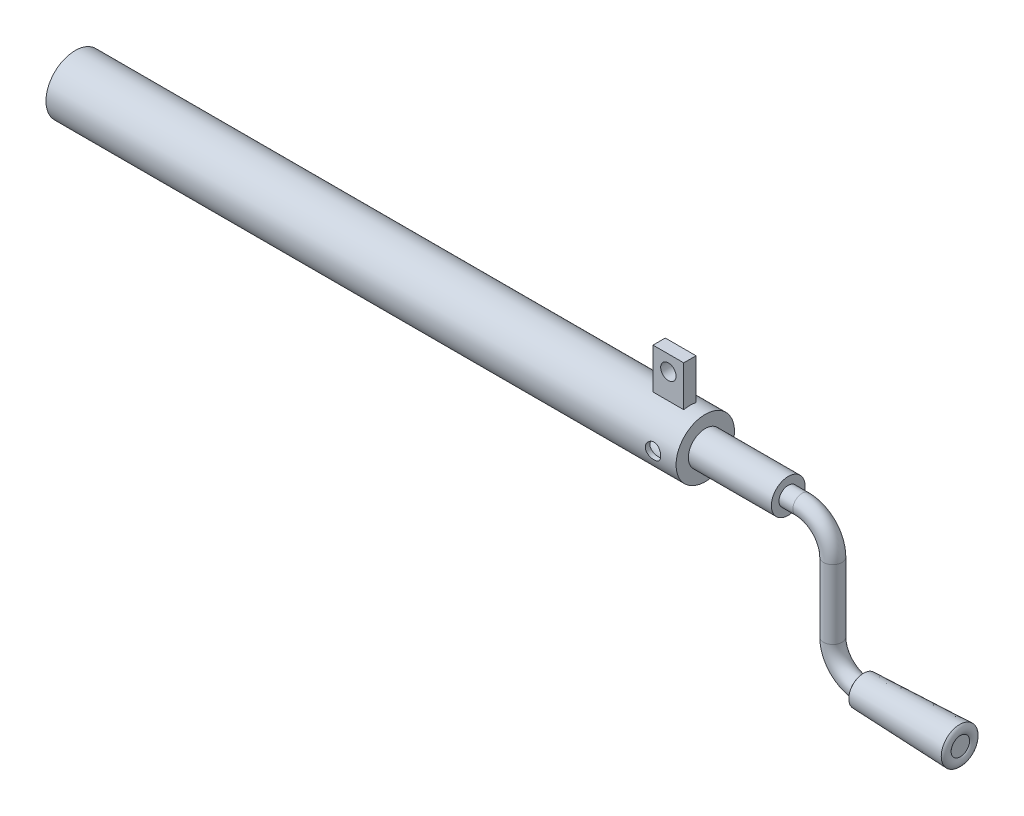
from build123d import *

# Parameters (mm, degrees)
SKETCH1_R                = 19
SKETCH1_R_2              = 16
BOSS_EXTRUDE1_DEPTH      = 410
SKETCH2_R                = 5
CUT_EXTRUDE1_DEPTH       = 30
BOSS_EXTRUDE2_REACH      = 417.4
BOSS_EXTRUDE2_END_RADIUS = 19
SKETCH3_W                = 20
SKETCH3_H                = 8
SKETCH4_R                = 5
CUT_EXTRUDE2_DEPTH       = 10
SWEEP1_PROFILE_R         = 6
BOSS_EXTRUDE3_START      = -10
SKETCH18_R               = 16
BOSS_EXTRUDE3_DEPTH      = 10
SKETCH19_R               = 11
SKETCH19_R_2             = 6
EXTRUDE_THIN1_DEPTH      = 54


with BuildPart() as part:
    # Sketch1 → Boss-Extrude1 (new body)
    with BuildSketch(Plane(origin=(0, 0, 0), x_dir=(0, 0, -1), z_dir=(1, 0, 0))):
        with Locations(Location((0, 0, 0), (0, 0, 180))):
            Circle(SKETCH1_R)
        with Locations(Location((0, 0, 0), (0, 0, 180))):
            Circle(SKETCH1_R_2, mode=Mode.SUBTRACT)
    extrude(amount=BOSS_EXTRUDE1_DEPTH)

    # Sketch2 → Cut-Extrude1 (cut, symmetric)
    with BuildSketch(Plane.XY):
        with Locations((395, 0)):
            Circle(SKETCH2_R)
    extrude(amount=CUT_EXTRUDE1_DEPTH, both=True, mode=Mode.SUBTRACT)

    # Boss-Extrude2: up to this cylinder (the profile starts outside it)
    boss_extrude2_end = Plane(origin=(390, 0, 0), z_dir=(-1, 0, 0)) * Cylinder(BOSS_EXTRUDE2_END_RADIUS, 873.8, mode=Mode.PRIVATE)
    # Sketch3 → Boss-Extrude2 (add, up to the surface)
    with BuildSketch(Plane(origin=(0, 45, 0), x_dir=(1, 0, 0), z_dir=(0, 1, 0)), mode=Mode.PRIVATE) as boss_extrude2_sk1:
        with Locations((390, 0)):
            Rectangle(SKETCH3_W, SKETCH3_H)
    boss_extrude2_tool1 = extrude(boss_extrude2_sk1.sketch, amount=-BOSS_EXTRUDE2_REACH, mode=Mode.PRIVATE) - boss_extrude2_end
    add(boss_extrude2_tool1.solids().sort_by_distance((390, 45, 0))[0])

    # Sketch4 → Cut-Extrude2 (cut)
    with BuildSketch(Plane.XY.offset(4)):
        with Locations((390, 35)):
            Circle(SKETCH4_R)
    extrude(amount=-CUT_EXTRUDE2_DEPTH, mode=Mode.SUBTRACT)



with BuildPart() as body_2:
    # Sweep1: sweep along a path in Sketch5
    with BuildLine(Plane.XY) as sweep1_path:
        Line((410, 0), (473, 0))
        ThreePointArc((473, 0), (487.142135624, -5.857864376), (493, -20))
        Line((493, -20), (493, -65))
        ThreePointArc((493, -65), (498.857864376, -79.142135624), (513, -85))
        Line((513, -85), (576, -85))
    # Sweep1 profile (on start of the path) → Sweep1 (sweep)
    with BuildSketch(Plane(origin=(410, 0, 0), x_dir=(0, 0, 1), z_dir=(1, 0, 0))):
        Circle(SWEEP1_PROFILE_R)
    sweep(path=sweep1_path.line)


with BuildPart() as part_1:
    add(part.part)

    add(body_2.part)  # Boss-Extrude3 merges body 2
    # Sketch18 → Boss-Extrude3 (add)
    with BuildSketch(Plane(origin=(410, 0, 0), x_dir=(0, 0, -1), z_dir=(1, 0, 0)).offset(BOSS_EXTRUDE3_START)):
        Circle(SKETCH18_R)
    extrude(amount=BOSS_EXTRUDE3_DEPTH)

    # Sketch20 → Revolve1 (revolve)
    with BuildSketch(Plane.XY, mode=Mode.PRIVATE) as revolve1_sk:
        with BuildLine():
            Line((513, -75.397094393), (575.526171182, -73.032864124))
            ThreePointArc((575.526171182, -73.032864124), (577.003176639, -75.917960888), (576, -79))
            Line((576, -79), (513, -79))
            ThreePointArc((513, -79), (512.253813817, -77.198547197), (513, -75.397094393))
        make_face()
    revolve(revolve1_sk.sketch.rotate(Axis((513, -85, 0), (1, 0, 0)), 90), axis=Axis((513, -85, 0), (1, 0, 0)))


with BuildPart() as body_2_2:
    # Sketch19 → Extrude-Thin1 (new body)
    with BuildSketch(Plane(origin=(410, 0, 0), x_dir=(0, 0, -1), z_dir=(1, 0, 0))):
        Circle(SKETCH19_R)
        Circle(SKETCH19_R_2, mode=Mode.SUBTRACT)
    extrude(amount=EXTRUDE_THIN1_DEPTH)


solid = Compound([part_1.part, body_2_2.part])
